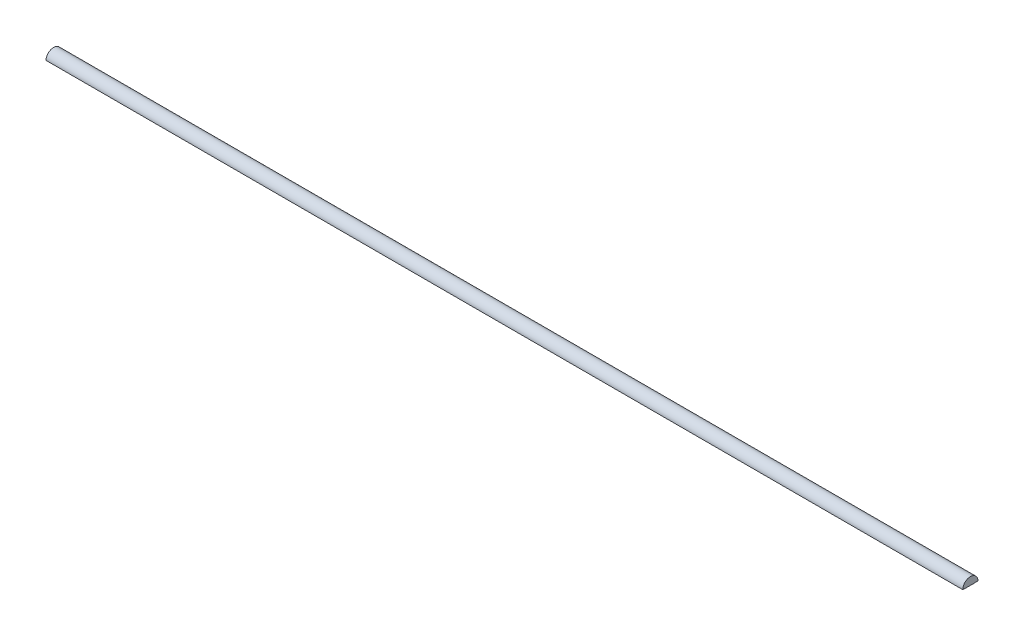
from build123d import *

# Parameters (mm, degrees)
BOSS_EXTRUDE1_DEPTH = 381


with BuildPart() as part:
    # Sketch1 → Boss-Extrude1 (new body)
    with BuildSketch(Plane(origin=(0, 0, 0), x_dir=(0, 0, -1), z_dir=(1, 0, 0))):
        with BuildLine():
            ThreePointArc((-3.174007657, -63.420625), (0, -63.5), (3.174007657, -63.420625))
            ThreePointArc((3.174007657, -63.420625), (0, -60.325), (-3.174007657, -63.420625))
        make_face()
    extrude(amount=BOSS_EXTRUDE1_DEPTH)


solid = part.part
